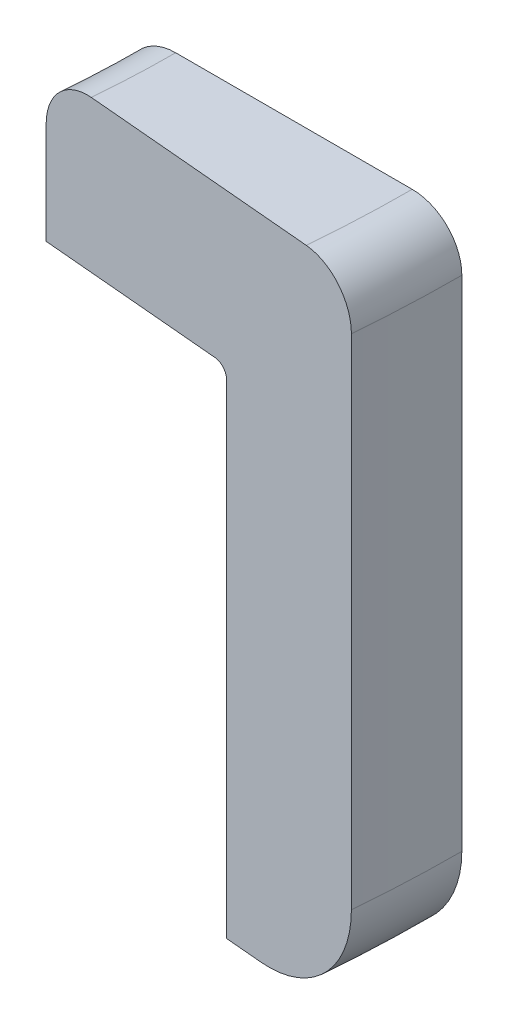
from build123d import *

# Parameters (mm, degrees)
REVOLVE1_ANGLE = 5


with BuildPart() as part:
    # Sketch1 → Revolve1 (revolve)
    with BuildSketch(Plane.XY):
        with BuildLine():
            Line((0, 0), (0, 13.5))
            ThreePointArc((0, 13.5), (-0.146446609, 13.853553391), (-0.5, 14))
            Line((-0.5, 14), (-8, 14))
            Line((-8, 14), (-8, 18.109583933))
            ThreePointArc((-8, 18.109583933), (-7.414213562, 19.523797495), (-6, 20.109583933))
            Line((-6, 20.109583933), (3.533069031, 20.109583933))
            ThreePointArc((3.533069031, 20.109583933), (4.947282593, 19.523797495), (5.533069031, 18.109583933))
            Line((5.533069031, 18.109583933), (5.533069031, 14))
            Line((5.533069031, 14), (5.533069031, 0))
            Line((5.533069031, 0), (5.533069031, -2))
            ThreePointArc((5.533069031, -2), (4.361496156, -4.828427125), (1.533069031, -6))
            Line((1.533069031, -6), (0, -6))
            Line((0, -6), (0, 0))
        make_face()
    revolve(axis=Axis((-43.4, 20.109583933, 0), (0, -1, 0)), revolution_arc=REVOLVE1_ANGLE)


solid = part.part
